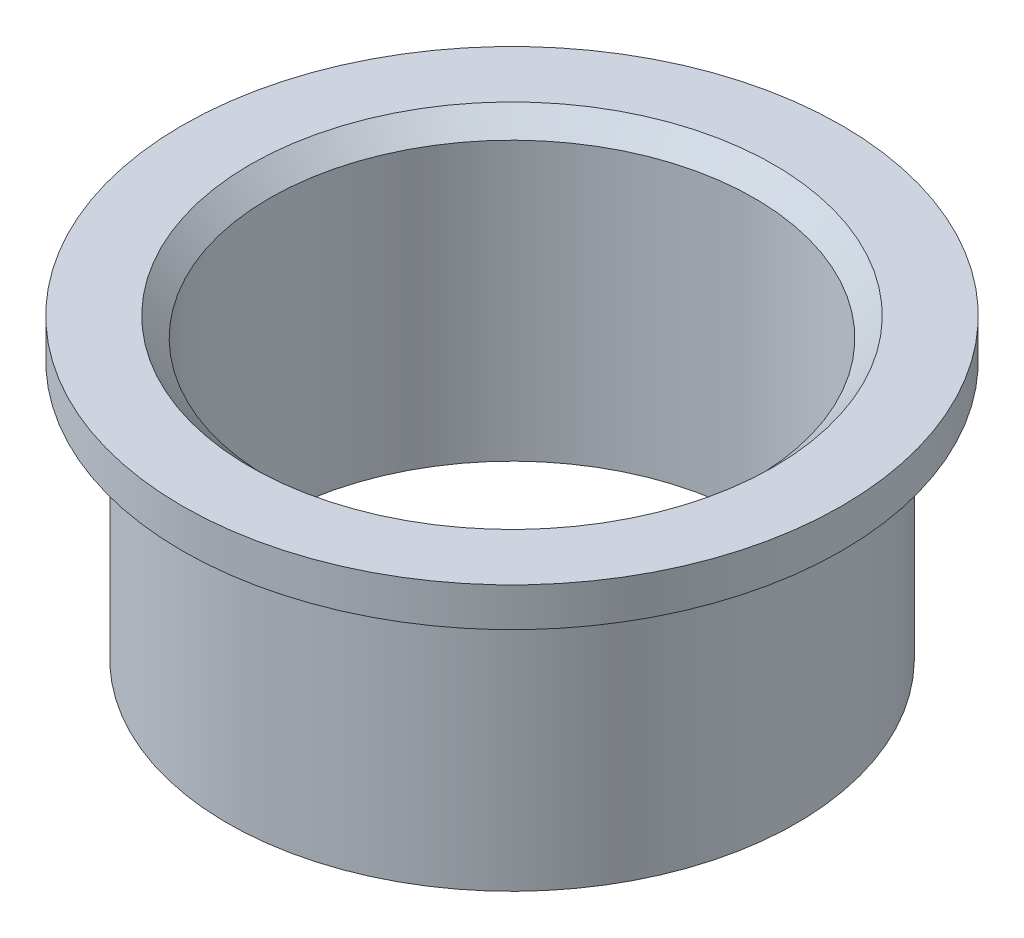
from build123d import *


with BuildPart() as part:
    # Sketch1 → Revolve1 (revolve)
    with BuildSketch(Plane.XY):
        Polygon((-51, 0), (-40.5, 0), (-37.5, -3), (-37.5, -46), (-44, -46), (-44, -6), (-51, -6), align=None)
    revolve(axis=Axis((0, 0, 0), (0, -1, 0)))


solid = part.part
